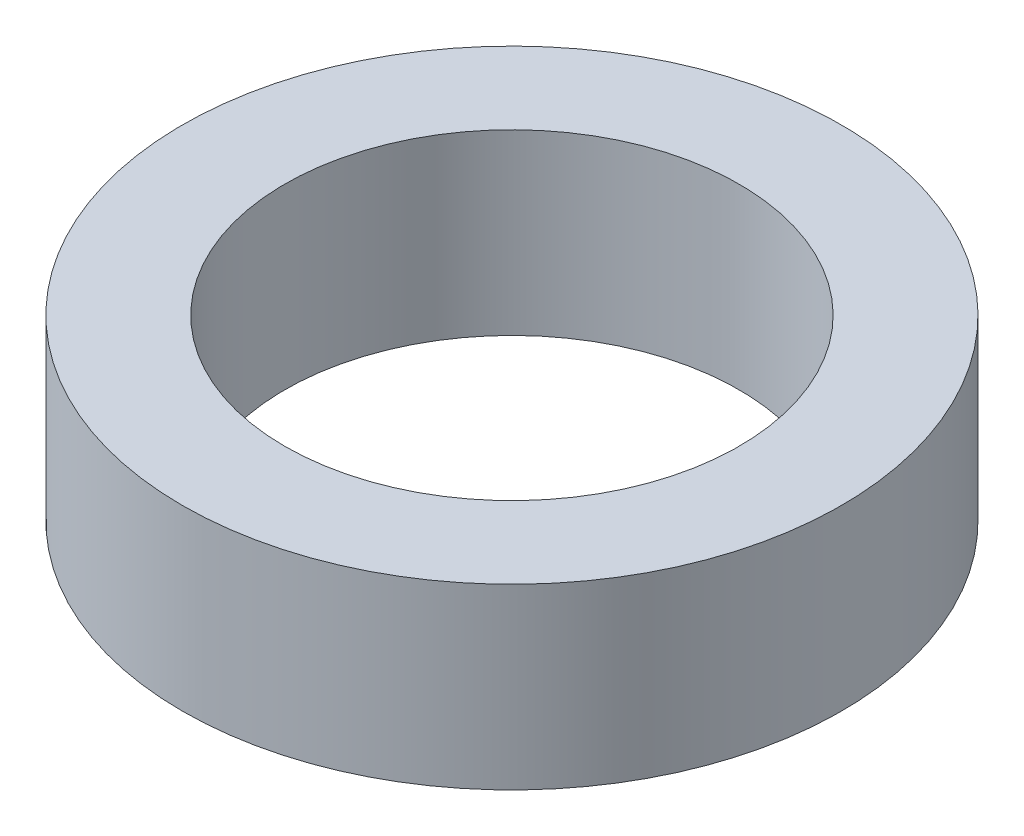
from build123d import *

# Parameters (mm, degrees)
CROQUIS1_R              = 7.4
CROQUIS1_R_2            = 5.1
SALIENTE_EXTRUIR1_DEPTH = 4


with BuildPart() as part:
    # Croquis1 → Saliente-Extruir1 (new body)
    with BuildSketch(Plane(origin=(0, 0, 0), x_dir=(1, 0, 0), z_dir=(0, 1, 0))):
        with Locations(Location((0, 0, 0), (0, 0, 270))):
            Circle(CROQUIS1_R)
        with Locations(Location((0, 0, 0), (0, 0, 270))):
            Circle(CROQUIS1_R_2, mode=Mode.SUBTRACT)
    extrude(amount=SALIENTE_EXTRUIR1_DEPTH)


solid = part.part
